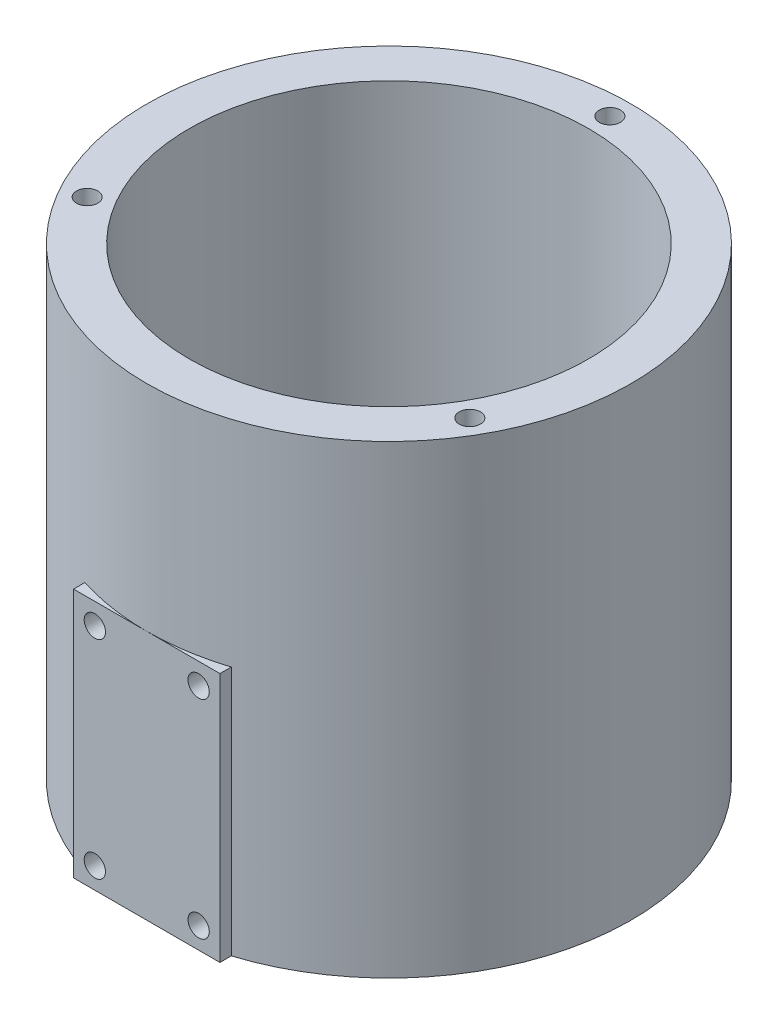
from build123d import *

# Parameters (mm, degrees)
SKETCH1_R                = 45.5
SKETCH1_R_2              = 33.5
BOSS_EXTRUDE1_DEPTH      = 4
SKETCH2_R                = 45.5
SKETCH2_R_2              = 37.5
BOSS_EXTRUDE2_DEPTH      = 83.3
SKETCH4_R                = 2
CUT_EXTRUDE1_DEPTH       = 6
CIRPATTERN1_COUNT        = 3
BOSS_EXTRUDE4_REACH      = 136.062
BOSS_EXTRUDE4_END_RADIUS = 45.5
SKETCH7_W                = 27.5
SKETCH7_H                = 47
SKETCH9_R                = 2
CUT_EXTRUDE2_DEPTH       = 6
SKETCH10_R               = 2
CUT_EXTRUDE3_DEPTH       = 6


with BuildPart() as part:
    # Sketch1 → Boss-Extrude1 (new body)
    with BuildSketch(Plane(origin=(0, 0, 0), x_dir=(1, 0, 0), z_dir=(0, 1, 0))):
        with Locations(Location((0, 0, 0), (0, 0, 270))):
            Circle(SKETCH1_R)
        with Locations(Location((0, 0, 0), (0, 0, 270))):
            Circle(SKETCH1_R_2, mode=Mode.SUBTRACT)
    extrude(amount=BOSS_EXTRUDE1_DEPTH)

    # Sketch2 → Boss-Extrude2 (add)
    with BuildSketch(Plane(origin=(0, 4, 0), x_dir=(1, 0, 0), z_dir=(0, 1, 0))):
        with Locations(Location((0, 0, 0), (0, 0, 270))):
            Circle(SKETCH2_R)
        with Locations(Location((0, 0, 0), (0, 0, 270))):
            Circle(SKETCH2_R_2, mode=Mode.SUBTRACT)
    extrude(amount=BOSS_EXTRUDE2_DEPTH)

    # Sketch4 → Cut-Extrude1 (cut)
    with BuildSketch(Plane(origin=(0, 87.3, 0), x_dir=(1, 0, 0), z_dir=(0, 1, 0))):
        with Locations(Location((0, 41.5, 0), (0, 0, 270))):
            Circle(SKETCH4_R)
    cut_extrude1 = extrude(amount=-CUT_EXTRUDE1_DEPTH, mode=Mode.SUBTRACT)

    # CirPattern1: Cut-Extrude1 ×3 about axis
    cirpattern1_axis = Axis((0, 0, 0), (0, 1, 0))
    for i in range(1, CIRPATTERN1_COUNT):
        add(cut_extrude1.rotate(cirpattern1_axis, i * 360 / CIRPATTERN1_COUNT), mode=Mode.SUBTRACT)

    # Boss-Extrude4: up to this cylinder (the profile starts outside it)
    boss_extrude4_end = Plane(origin=(0, 23.5, 0), z_dir=(0, -1, 0)) * Cylinder(BOSS_EXTRUDE4_END_RADIUS, 364.124, mode=Mode.PRIVATE)
    # Sketch7 → Boss-Extrude4 (add, up to the surface)
    with BuildSketch(Plane(origin=(0, 87.3, 45.5), x_dir=(1, 0, 0), z_dir=(0, 0, 1)), mode=Mode.PRIVATE) as boss_extrude4_sk1:
        with Locations((0, -63.8)):
            Rectangle(SKETCH7_W, SKETCH7_H)
    boss_extrude4_tool1 = extrude(boss_extrude4_sk1.sketch, amount=-BOSS_EXTRUDE4_REACH, mode=Mode.PRIVATE) - boss_extrude4_end
    add(boss_extrude4_tool1.solids().sort_by_distance((0, 23.5, 45.5))[0])
    add(boss_extrude4_tool1.solids().sort_by_distance((0, 23.5, 45.5))[1])

    # Sketch9 → Cut-Extrude2 (cut)
    with BuildSketch(Plane.XY.offset(45.5)):
        with Locations((-9.75, 4)):
            Circle(SKETCH9_R)
        with Locations((9.75, 4)):
            Circle(SKETCH9_R)
    extrude(amount=-CUT_EXTRUDE2_DEPTH, mode=Mode.SUBTRACT)

    # Sketch10 → Cut-Extrude3 (cut)
    with BuildSketch(Plane.XY.offset(45.5)):
        with Locations((-9.75, 43)):
            Circle(SKETCH10_R)
        with Locations((9.75, 43)):
            Circle(SKETCH10_R)
    extrude(amount=-CUT_EXTRUDE3_DEPTH, mode=Mode.SUBTRACT)


solid = part.part
